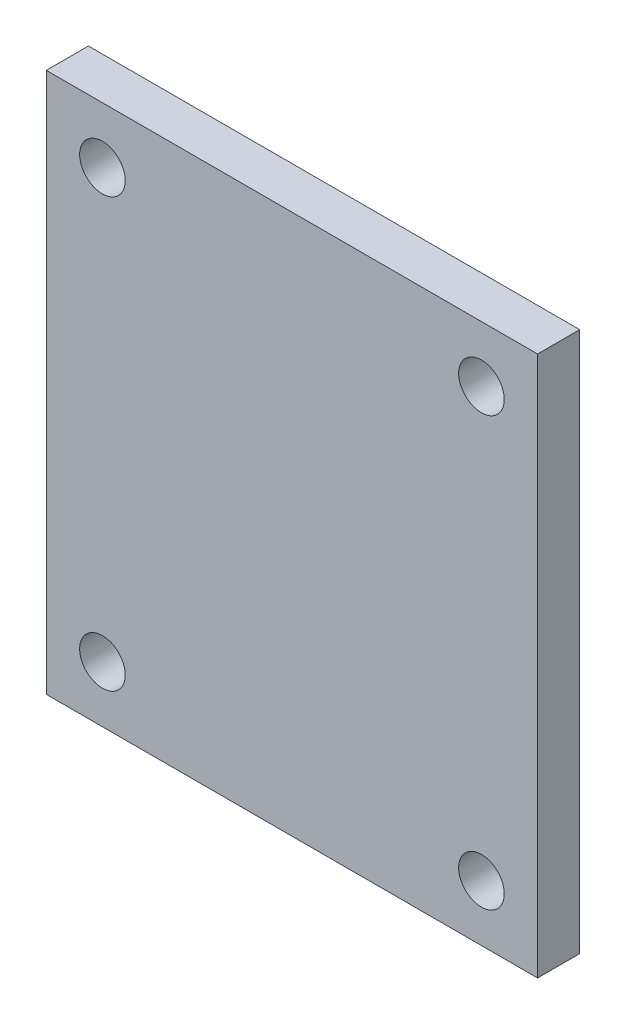
from build123d import *

# Parameters (mm, degrees)
SKETCH1_W           = 140
SKETCH1_H           = 154
SKETCH1_R           = 6.5
BOSS_EXTRUDE1_DEPTH = 6


with BuildPart() as part:
    # Sketch1 → Boss-Extrude1 (new, symmetric)
    with BuildSketch(Plane.XY):
        Rectangle(SKETCH1_W, SKETCH1_H)
        with Locations((-54, 61)):
            Circle(SKETCH1_R, mode=Mode.SUBTRACT)
        with Locations(Location((54, 61, 0), (0, 0, 180))):
            Circle(SKETCH1_R, mode=Mode.SUBTRACT)
        with Locations(Location((-54, -61, 0), (0, 0, 180))):
            Circle(SKETCH1_R, mode=Mode.SUBTRACT)
        with Locations((54, -61)):
            Circle(SKETCH1_R, mode=Mode.SUBTRACT)
    extrude(amount=BOSS_EXTRUDE1_DEPTH, both=True)


solid = part.part
